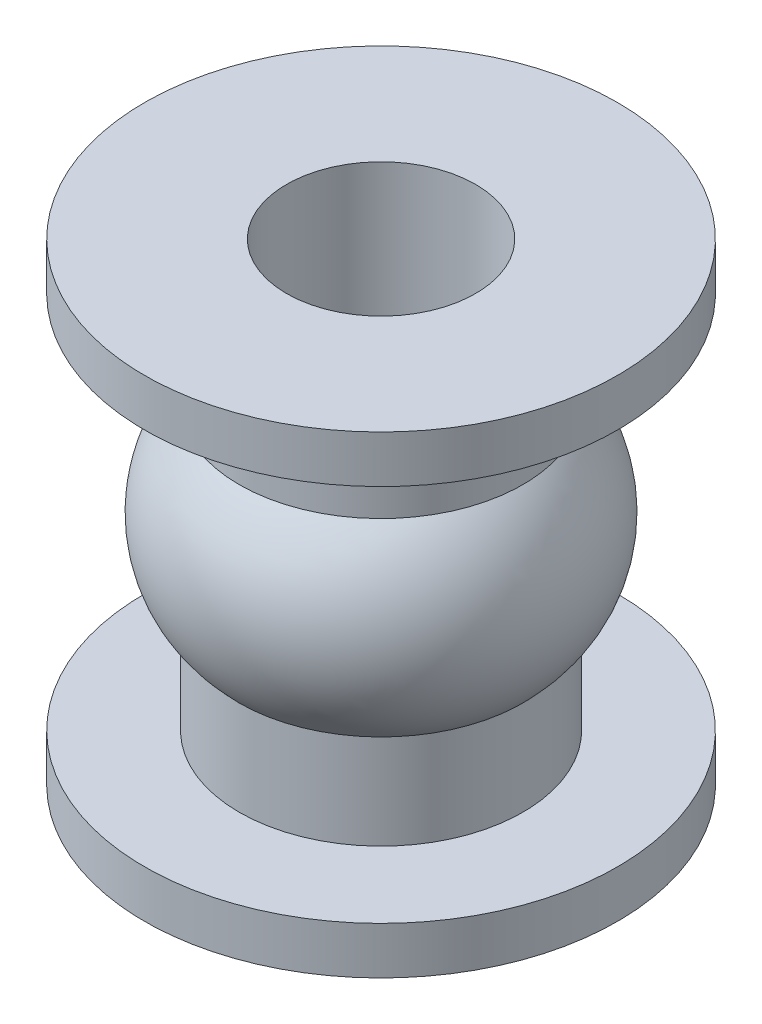
from build123d import *


with BuildPart() as part:
    # Croquis1 → Revolución1 (revolve)
    with BuildSketch(Plane.XY, mode=Mode.PRIVATE) as revoluci_n1_sk:
        with BuildLine():
            Line((-2, 10), (-5, 10))
            Line((-5, 10), (-5, 9))
            Line((-5, 9), (-3, 9))
            Line((-3, 9), (-3, 7))
            ThreePointArc((-3, 7), (-3.828427125, 5), (-3, 3))
            Line((-3, 3), (-3, 1))
            Line((-3, 1), (-5, 1))
            Line((-5, 1), (-5, 0))
            Line((-5, 0), (-2, 0))
            Line((-2, 0), (-2, 10))
        make_face()
    revolve(revoluci_n1_sk.sketch.rotate(Axis((0, 0, 0), (0, 1, 0)), 270), axis=Axis((0, 0, 0), (0, 1, 0)))


solid = part.part
